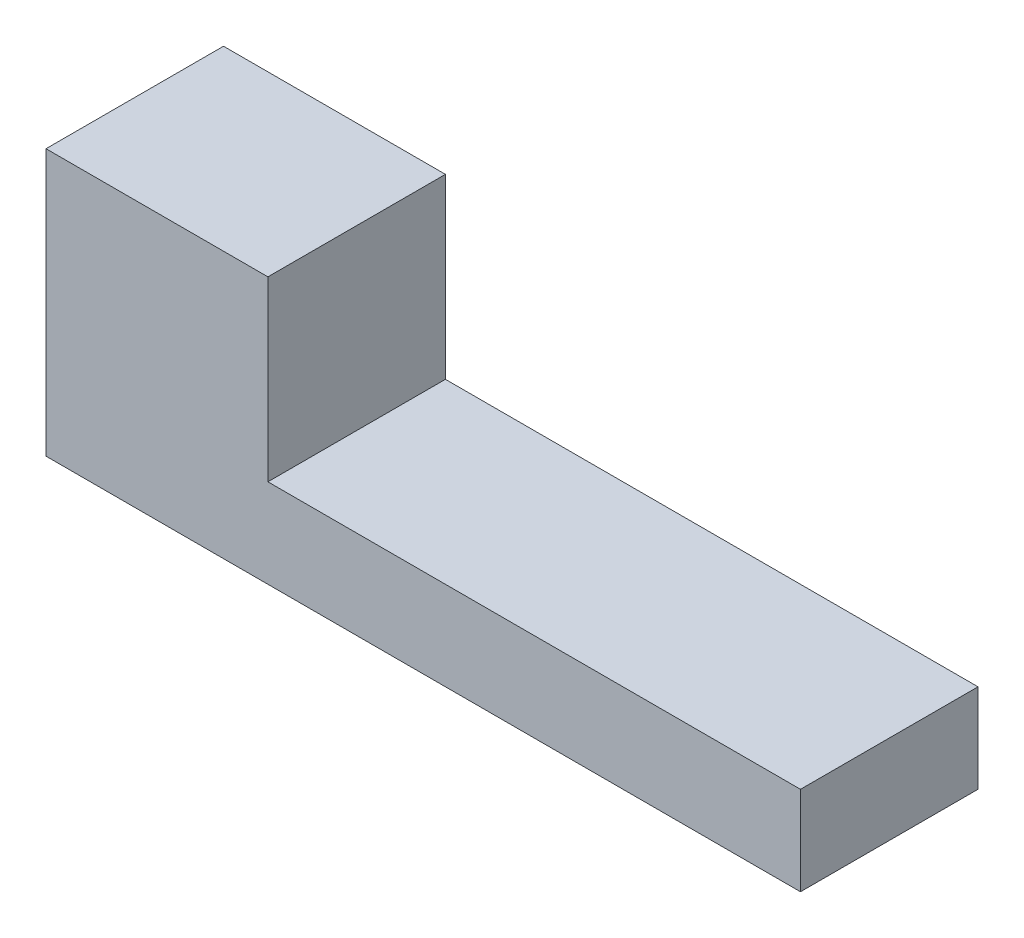
from build123d import *

# Parameters (mm, degrees)
SKETCH1_W           = 850
SKETCH1_H           = 200
BOSS_EXTRUDE1_DEPTH = 100
SKETCH2_W           = 250
SKETCH2_H           = 200
BOSS_EXTRUDE2_DEPTH = 200


with BuildPart() as part:
    # Sketch1 → Boss-Extrude1 (new body)
    with BuildSketch(Plane(origin=(0, 0, 0), x_dir=(1, 0, 0), z_dir=(0, 1, 0))):
        with Locations((425, 100)):
            Rectangle(SKETCH1_W, SKETCH1_H)
    extrude(amount=BOSS_EXTRUDE1_DEPTH)

    # Sketch2 → Boss-Extrude2 (add)
    with BuildSketch(Plane(origin=(0, 100, 0), x_dir=(1, 0, 0), z_dir=(0, 1, 0))):
        with Locations((125, 100)):
            Rectangle(SKETCH2_W, SKETCH2_H)
    extrude(amount=BOSS_EXTRUDE2_DEPTH)


solid = part.part
